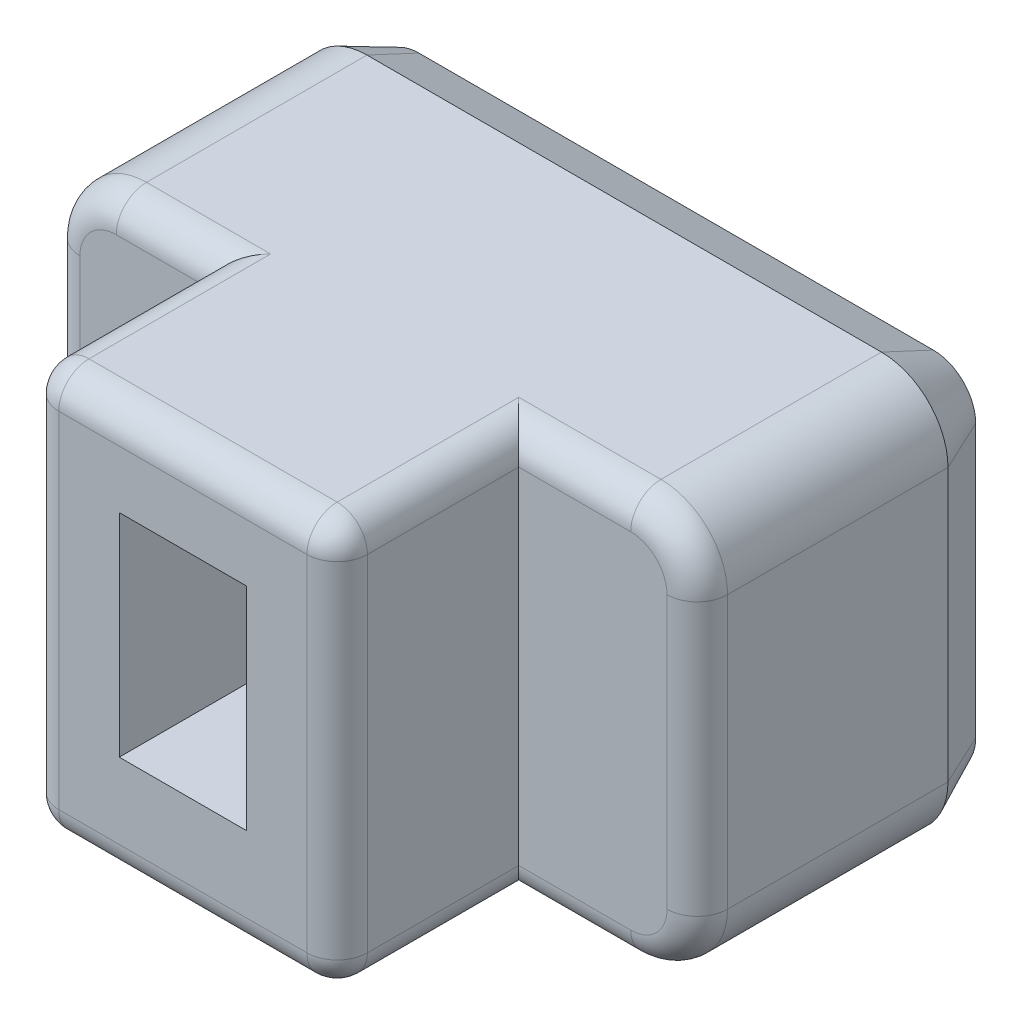
from build123d import *

# Parameters (mm, degrees)
BOSS_EXTRU_1_DEPTH      = 8
ESQUISSE3_W             = 2.1
ESQUISSE3_H             = 3.5
ENL_V_MAT_EXTRU_1_DEPTH = 3
ESQUISSE4_OUTSIDE_W     = 15.69
ESQUISSE4_OUTSIDE_H     = 11.69
ESQUISSE4_OUTSIDE_W_2   = 5.1
ESQUISSE4_OUTSIDE_H_2   = 6.7
ENL_V_MAT_EXTRU_2_DEPTH = 3
CONG_1_R                = 0.5
CHANFREIN1_SIZE         = 0.4
CHANFREIN1_SIZE2        = 0.857802768
ENL_V_MAT_EXTRU_3_DEPTH = 0.3
BOSS_EXTRU_2_START      = -0.2
BOSS_EXTRU_2_DEPTH      = 0.2
BOSS_EXTRU_2_2_DEPTH    = 0.2
BOSS_EXTRU_2_3_DEPTH    = 0.2
BOSS_EXTRU_2_4_DEPTH    = 0.2


with BuildPart() as part:
    # Esquisse2 → Boss.-Extru.1 (new body)
    with BuildSketch(Plane.XY):
        with BuildLine():
            Line((1.1, 0), (9.6, 0))
            ThreePointArc((9.6, 0), (10.377817459, 0.322182541), (10.7, 1.1))
            Line((10.7, 1.1), (10.7, 5.6))
            ThreePointArc((10.7, 5.6), (10.377817459, 6.377817459), (9.6, 6.7))
            Line((9.6, 6.7), (1.1, 6.7))
            ThreePointArc((1.1, 6.7), (0.322182541, 6.377817459), (0, 5.6))
            Line((0, 5.6), (0, 1.1))
            ThreePointArc((0, 1.1), (0.322182541, 0.322182541), (1.1, 0))
        make_face()
    extrude(amount=BOSS_EXTRU_1_DEPTH)

    # Esquisse3 → Enlèv. mat.-Extru.1 (cut)
    with BuildSketch(Plane.XY.offset(8)):
        with Locations((5.2, 3.5)):
            Rectangle(ESQUISSE3_W, ESQUISSE3_H)
    extrude(amount=-ENL_V_MAT_EXTRU_1_DEPTH, mode=Mode.SUBTRACT)

    # Esquisse4 outside → Enlèv. mat.-Extru.2 (cut)
    with BuildSketch(Plane.XY.offset(8)):
        with Locations((5.35, 3.35)):
            Rectangle(ESQUISSE4_OUTSIDE_W, ESQUISSE4_OUTSIDE_H)
        with Locations((5.2, 3.35)):
            Rectangle(ESQUISSE4_OUTSIDE_W_2, ESQUISSE4_OUTSIDE_H_2, mode=Mode.SUBTRACT)
    extrude(amount=-ENL_V_MAT_EXTRU_2_DEPTH, mode=Mode.SUBTRACT)

    # Congé1
    cong_1_edges = [part.edges().sort_by_distance(p)[0] for p in [
        (8.675, 0, 5),
        (10.377817459, 0.322182541, 5),
        (10.7, 3.35, 5),
        (10.377817459, 6.377817459, 5),
        (1.875, 6.7, 5),
        (0.322182541, 6.377817459, 5),
        (1.875, 0, 5),
        (0.322182541, 0.322182541, 5),
        (7.75, 6.7, 6.5),
        (2.65, 6.7, 6.5),
        (7.75, 0, 6.5),
        (2.65, 0, 6.5),
        (2.65, 3.35, 8),
        (5.2, 6.7, 8),
        (7.75, 3.35, 8),
        (5.2, 0, 8),
        (8.675, 6.7, 5),
        (0, 3.35, 5),
    ]]
    fillet(cong_1_edges, radius=CONG_1_R)

    # Chanfrein1
    chanfrein1_edges = [part.edges().sort_by_distance(p)[0] for p in [
        (5.35, 0, 0),
        (10.377817459, 0.322182541, 0),
        (0.322182541, 0.322182541, 0),
        (10.7, 3.35, 0),
        (0, 3.35, 0),
        (10.377817459, 6.377817459, 0),
        (0.322182541, 6.377817459, 0),
        (5.35, 6.7, 0),
    ]]
    chanfrein1_side = [part.faces().sort_by_distance(p)[0] for p in [
        (5.35, 3.35, 0),
    ]]
    chamfer(chanfrein1_edges, length=CHANFREIN1_SIZE, length2=CHANFREIN1_SIZE2, reference=chanfrein1_side[0])

    # Esquisse5 → Enlèv. mat.-Extru.3 (cut)
    # profile 1 of 4: a face of its own
    with BuildSketch(Plane.XY.offset(0.2)):
        with BuildLine():
            Line((1.026823853, 1.568560809), (1.504988917, 1.568560809))
            add(Edge.make_bspline(
                [(1.504988917, 1.568560809), (1.528371843, 1.568737972), (1.573791171, 1.569082096), (1.639742358, 1.574368325), (1.701660368, 1.581533005), (1.759061592, 1.593274377), (1.813075404, 1.605942815), (1.862432078, 1.623594565), (1.907734307, 1.643935254), (1.96262283, 1.675076795), (2.024825483, 1.723696766), (2.090721146, 1.794786229), (2.147567697, 1.87955967), (2.196135604, 1.975912141), (2.234931561, 2.081846849), (2.262975431, 2.194892992), (2.280123943, 2.313560969), (2.282186514, 2.394658433), (2.28323411, 2.43584847)],
                knots=[0, 0, 0, 0, 0.842819012, 1.637103715, 2.384406922, 3.08841103, 3.748535063, 4.382822, 4.974900166, 5.537207606, 6.654665112, 7.805399938, 9.018406966, 10.322311616, 11.68730139, 13.077036195, 14.51540382, 16, 16, 16, 16], degree=3))
            add(Edge.make_bspline(
                [(2.28323411, 2.43584847), (2.282193179, 2.474442117), (2.280155458, 2.549992895), (2.267086011, 2.660666673), (2.243442129, 2.765609887), (2.212514271, 2.865249978), (2.171970391, 2.957751767), (2.12300298, 3.04203836), (2.064299985, 3.116552922), (2.018992008, 3.159230389), (1.996475296, 3.180439816)],
                knots=[0, 0, 0, 0, 1.126158788, 2.204564197, 3.24522682, 4.260993767, 5.244170441, 6.18562216, 7.098308387, 8, 8, 8, 8], degree=3))
            add(Edge.make_bspline(
                [(1.996475296, 3.180439816), (2.024188074, 3.19573908), (2.077707144, 3.225285102), (2.14971342, 3.278030757), (2.212499474, 3.333687309), (2.265616711, 3.394594825), (2.309939208, 3.461112639), (2.349514613, 3.533062439), (2.383553785, 3.611508308), (2.412462035, 3.695834512), (2.434514084, 3.78528162), (2.450578194, 3.878766345), (2.460632936, 3.975761407), (2.462017997, 4.041626774), (2.462721289, 4.075071226)],
                knots=[0, 0, 0, 0, 1.068238828, 2.062988629, 3.007648102, 3.897274313, 4.783988941, 5.702528668, 6.667549239, 7.668574733, 8.710083789, 9.775548232, 10.870490309, 12, 12, 12, 12], degree=3))
            add(Edge.make_bspline(
                [(2.462721289, 4.075071226), (2.462027316, 4.109217601), (2.460664962, 4.176251103), (2.450568908, 4.274636088), (2.434772444, 4.368946942), (2.411560754, 4.459268709), (2.381135043, 4.545298672), (2.345659478, 4.627988931), (2.302459892, 4.706259252), (2.253008767, 4.779739824), (2.199305822, 4.847993928), (2.138845376, 4.906649371), (2.074306301, 4.956769773), (2.005065591, 4.997765953), (1.931575893, 5.029659183), (1.853531864, 5.051869225), (1.771043067, 5.066690144), (1.714224065, 5.067927998), (1.685177219, 5.068560809)],
                knots=[0, 0, 0, 0, 1.162187583, 2.281516105, 3.363145735, 4.414750599, 5.451352767, 6.466734603, 7.474357677, 8.489334277, 9.479565483, 10.42470061, 11.349220251, 12.255172587, 13.156677859, 14.068063032, 15.012360734, 16, 16, 16, 16], degree=3))
            Line((1.685177219, 5.068560809), (1.026823853, 5.068560809))
            Line((1.026823853, 5.068560809), (1.026823853, 1.568560809))
        make_face()
        with BuildLine():
            Line((1.251182828, 1.927535168), (1.251182828, 3.04933004))
            Line((1.251182828, 3.04933004), (1.397016161, 3.04933004))
            add(Edge.make_bspline(
                [(1.397016161, 3.04933004), (1.438412129, 3.048617815), (1.515585022, 3.047290043), (1.622881139, 3.035393479), (1.712741507, 3.014174794), (1.787369187, 2.984681375), (1.848838087, 2.944029726), (1.90155063, 2.894261214), (1.948550417, 2.835153527), (1.987789737, 2.766952898), (2.019007319, 2.691884325), (2.042497219, 2.612533975), (2.055849417, 2.528610242), (2.057851087, 2.471417967), (2.058875135, 2.442158566)],
                knots=[0, 0, 0, 0, 1.443642421, 2.691326396, 3.756960278, 4.656140177, 5.474583852, 6.310856787, 7.17526069, 8.099403828, 9.045608876, 10.00520231, 10.979467334, 12, 12, 12, 12], degree=3))
            add(Edge.make_bspline(
                [(2.058875135, 2.442158566), (2.057575551, 2.404158825), (2.055093558, 2.331585542), (2.031455454, 2.229126814), (1.993897311, 2.138840762), (1.948449461, 2.074453895), (1.904696232, 2.031076558), (1.866581781, 2.003587702), (1.824564806, 1.979319355), (1.777016971, 1.961040965), (1.725872029, 1.945137024), (1.669842749, 1.935050235), (1.609608819, 1.928631751), (1.567874451, 1.927908233), (1.546355103, 1.927535168)],
                knots=[0, 0, 0, 0, 1.642379725, 3.136676343, 4.523260359, 5.850774948, 6.515975718, 7.181560886, 7.879119346, 8.609773276, 9.380960541, 10.194310665, 11.068938667, 12, 12, 12, 12], degree=3))
            Line((1.546355103, 1.927535168), (1.251182828, 1.927535168))
        make_face(mode=Mode.SUBTRACT)
        with BuildLine():
            Line((1.251182828, 3.408304399), (1.251182828, 4.70958645))
            Line((1.251182828, 4.70958645), (1.558975296, 4.70958645))
            add(Edge.make_bspline(
                [(1.558975296, 4.70958645), (1.580941016, 4.709169721), (1.623253584, 4.708366975), (1.684650814, 4.706384891), (1.741123436, 4.699338118), (1.793517508, 4.692398226), (1.8410261, 4.681236116), (1.884912512, 4.670321367), (1.923252585, 4.654406628), (1.968862855, 4.632036867), (2.019713585, 4.596420131), (2.074700893, 4.544350096), (2.122989063, 4.481580211), (2.163584377, 4.40949892), (2.197307547, 4.331601417), (2.22115126, 4.248918562), (2.235424533, 4.162974041), (2.237376372, 4.104572105), (2.238362315, 4.075071226)],
                knots=[0, 0, 0, 0, 0.99003773, 1.907109671, 2.76528307, 3.553060015, 4.286309396, 4.963262082, 5.587021761, 6.152117271, 7.25031408, 8.367579186, 9.553401143, 10.803317956, 12.08641526, 13.369382935, 14.671182516, 16, 16, 16, 16], degree=3))
            add(Edge.make_bspline(
                [(2.238362315, 4.075071226), (2.237282379, 4.038515816), (2.235175023, 3.967182644), (2.214922404, 3.864112086), (2.182606238, 3.767864804), (2.13712823, 3.680037298), (2.080985932, 3.601287437), (2.012232997, 3.537354168), (1.935634971, 3.48383751), (1.877859898, 3.461173001), (1.848538597, 3.449670585)],
                knots=[0, 0, 0, 0, 1.112466578, 2.170835206, 3.186211385, 4.195579665, 5.173863365, 6.115585149, 7.043644711, 8, 8, 8, 8], degree=3))
            add(Edge.make_bspline(
                [(1.848538597, 3.449670585), (1.836661523, 3.44623022), (1.811263186, 3.438873229), (1.769503167, 3.430760766), (1.721775614, 3.423758624), (1.667925084, 3.418604251), (1.608376282, 3.413196523), (1.542855896, 3.411063775), (1.471353423, 3.40857673), (1.421558511, 3.408397686), (1.395613917, 3.408304399)],
                knots=[0, 0, 0, 0, 0.650249806, 1.390516148, 2.235578867, 3.187401739, 4.236027799, 5.380534347, 6.635182444, 8, 8, 8, 8], degree=3))
            Line((1.395613917, 3.408304399), (1.251182828, 3.408304399))
        make_face(mode=Mode.SUBTRACT)
    # profile 2 of 4: a face of its own
    with BuildSketch(Plane.XY.offset(0.2)):
        Polygon((3.808875135, 1.568560809), (4.840926417, 5.068560809), (4.596234911, 5.068560809), (4.265305424, 3.946765938), (3.307573052, 3.946765938), (2.976643565, 5.068560809), (2.731952058, 5.068560809), (3.76400334, 1.568560809), align=None)
        Polygon((3.786439238, 2.322266739), (3.413442443, 3.587791579), (4.160137155, 3.587791579), align=None, mode=Mode.SUBTRACT)
    # profile 3 of 4: a face of its own
    with BuildSketch(Plane.XY.offset(0.2)):
        with BuildLine():
            Line((5.424259751, 1.568560809), (5.896114719, 1.568560809))
            add(Edge.make_bspline(
                [(5.896114719, 1.568560809), (5.927664944, 1.568710504), (5.987968691, 1.568996623), (6.074721645, 1.570732774), (6.153214864, 1.575384221), (6.224145044, 1.579633475), (6.286726392, 1.587040741), (6.341839583, 1.594195908), (6.388969613, 1.603775549), (6.417331173, 1.612312494), (6.430369526, 1.616237091)],
                knots=[0, 0, 0, 0, 1.407282149, 2.689818686, 3.869392946, 4.914346335, 5.858282058, 6.679401601, 7.392895548, 8, 8, 8, 8], degree=3))
            add(Edge.make_bspline(
                [(6.430369526, 1.616237091), (6.447603971, 1.622618673), (6.482210576, 1.635432831), (6.531233225, 1.661982143), (6.578319208, 1.692710749), (6.622937805, 1.728678378), (6.664151442, 1.770550506), (6.7036174, 1.816726381), (6.739924964, 1.868415449), (6.774502964, 1.92428896), (6.804944325, 1.984927743), (6.831532873, 2.049228254), (6.855271559, 2.116634357), (6.872532138, 2.187985883), (6.888151364, 2.262183199), (6.897131184, 2.340098595), (6.903943562, 2.42123829), (6.904663431, 2.476497587), (6.905028981, 2.504558406)],
                knots=[0, 0, 0, 0, 0.821107668, 1.648776614, 2.486680283, 3.333986144, 4.206203121, 5.111011076, 6.047917916, 7.028589376, 8.047728764, 9.078595037, 10.139756632, 11.240097913, 12.359441704, 13.528961701, 14.745200183, 16, 16, 16, 16], degree=3))
            add(Edge.make_bspline(
                [(6.905028981, 2.504558406), (6.904115372, 2.551133706), (6.902340852, 2.641597712), (6.883932957, 2.772696903), (6.856665517, 2.895620891), (6.816713721, 3.008968609), (6.766854772, 3.112017745), (6.705365767, 3.201831055), (6.634583345, 3.278696083), (6.567223984, 3.332191765), (6.507220008, 3.366287223), (6.458849711, 3.389996258), (6.40567214, 3.408404155), (6.34888735, 3.424778097), (6.287907436, 3.437149218), (6.223057013, 3.446239396), (6.154226494, 3.451898922), (6.106929647, 3.452742492), (6.082613116, 3.453176194)],
                knots=[0, 0, 0, 0, 1.558910601, 3.027898852, 4.425391045, 5.769631485, 7.043839751, 8.248801688, 9.400892743, 10.532946836, 11.111592315, 11.710273231, 12.334210728, 12.99329447, 13.688700629, 14.415975114, 15.185611873, 16, 16, 16, 16], degree=3))
            Line((6.082613116, 3.453176194), (6.949900776, 5.068560809))
            Line((6.949900776, 5.068560809), (6.665245328, 5.068560809))
            Line((6.665245328, 5.068560809), (5.797957667, 3.453176194))
            Line((5.797957667, 3.453176194), (5.648618725, 3.453176194))
            Line((5.648618725, 3.453176194), (5.648618725, 5.068560809))
            Line((5.648618725, 5.068560809), (5.424259751, 5.068560809))
            Line((5.424259751, 5.068560809), (5.424259751, 1.568560809))
        make_face()
        with BuildLine():
            Line((5.648618725, 1.927535168), (5.648618725, 3.094201835))
            Line((5.648618725, 3.094201835), (6.069992924, 3.099109688))
            add(Edge.make_bspline(
                [(6.069992924, 3.099109688), (6.108123391, 3.098362877), (6.179222189, 3.096970359), (6.278198619, 3.085453727), (6.361837628, 3.066169237), (6.431109705, 3.036780445), (6.488928859, 2.997996719), (6.538174101, 2.949730875), (6.580828757, 2.891535854), (6.616506866, 2.824862482), (6.64534297, 2.751195421), (6.665123976, 2.67246143), (6.678491409, 2.589612011), (6.679932383, 2.532891903), (6.680670007, 2.503857284)],
                knots=[0, 0, 0, 0, 1.395339324, 2.601776402, 3.641253506, 4.52639321, 5.340202216, 6.175051148, 7.037367115, 7.971344434, 8.935623254, 9.925331959, 10.93799221, 12, 12, 12, 12], degree=3))
            add(Edge.make_bspline(
                [(6.680670007, 2.503857284), (6.67990819, 2.475758408), (6.678408332, 2.42043759), (6.665195213, 2.339666097), (6.6452648, 2.26225379), (6.61588566, 2.190467215), (6.580723986, 2.125106562), (6.539134009, 2.069096432), (6.492430195, 2.022849454), (6.438973616, 1.984623005), (6.372267342, 1.957387389), (6.289865436, 1.941003702), (6.190721095, 1.928580374), (6.118654936, 1.927901244), (6.079808629, 1.927535168)],
                knots=[0, 0, 0, 0, 1.05047501, 2.068165954, 3.054309154, 4.03493336, 4.962272413, 5.82433758, 6.634237283, 7.412809464, 8.266946403, 9.306301865, 10.547997739, 12, 12, 12, 12], degree=3))
            Line((6.079808629, 1.927535168), (5.648618725, 1.927535168))
        make_face(mode=Mode.SUBTRACT)
    # profile 4 of 4: a face of its own
    with BuildSketch(Plane.XY.offset(0.2)):
        with BuildLine():
            add(Edge.make_bspline(
                [(8.549860712, 1.47881722), (8.59414111, 1.480464969), (8.681755943, 1.483725266), (8.810191444, 1.508788948), (8.932994177, 1.550691536), (9.050230994, 1.609392991), (9.161477685, 1.685356446), (9.267367173, 1.777321817), (9.366881747, 1.88620788), (9.460052092, 2.009812749), (9.544938935, 2.14532399), (9.618437417, 2.290671687), (9.681896144, 2.442808086), (9.73302479, 2.60308619), (9.773097035, 2.770630668), (9.80048138, 2.946263138), (9.818855566, 3.129101174), (9.820738453, 3.253777401), (9.821695648, 3.317158566)],
                knots=[0, 0, 0, 0, 0.858454251, 1.698569343, 2.527121736, 3.368410003, 4.233397776, 5.133164337, 6.082708235, 7.089035219, 8.131704346, 9.179798448, 10.244696421, 11.325576536, 12.439338355, 13.582515966, 14.771033121, 16, 16, 16, 16], degree=3))
            add(Edge.make_bspline(
                [(9.821695648, 3.317158566), (9.820635807, 3.380061448), (9.818551605, 3.503761403), (9.80161986, 3.685605125), (9.772809048, 3.860103515), (9.733043964, 4.027263972), (9.681717099, 4.187137068), (9.61915252, 4.339760226), (9.545613348, 4.485458347), (9.460646541, 4.62184395), (9.367514929, 4.746164564), (9.26980585, 4.856959315), (9.165049905, 4.949295858), (9.056277675, 5.026222489), (8.941324129, 5.084859517), (8.821948031, 5.127386554), (8.697297237, 5.153604764), (8.612386108, 5.156727107), (8.569492123, 5.158304399)],
                knots=[0, 0, 0, 0, 1.228341011, 2.415560641, 3.562873061, 4.679897651, 5.768252433, 6.838774251, 7.898184844, 8.951936584, 9.972515691, 10.929235922, 11.831364861, 12.693632108, 13.524448546, 14.342987726, 15.162938237, 16, 16, 16, 16], degree=3))
            add(Edge.make_bspline(
                [(8.569492123, 5.158304399), (8.525892517, 5.156753036), (8.439812083, 5.153690117), (8.313902928, 5.127309494), (8.193139649, 5.085633156), (8.077525723, 5.026957535), (7.967421403, 4.95106212), (7.863159907, 4.858086681), (7.764376306, 4.748600007), (7.671304309, 4.624652739), (7.586726345, 4.488916419), (7.511707733, 4.344765829), (7.449952451, 4.192763075), (7.397456958, 4.034651322), (7.357520031, 3.869295521), (7.330177117, 3.696941954), (7.311699147, 3.517846044), (7.309827123, 3.395965749), (7.308875135, 3.333985489)],
                knots=[0, 0, 0, 0, 0.853619607, 1.685335118, 2.509462992, 3.351267867, 4.217631045, 5.122828636, 6.082475418, 7.102863462, 8.156314248, 9.213263494, 10.283190882, 11.367953664, 12.475420875, 13.61233573, 14.785791812, 16, 16, 16, 16], degree=3))
            add(Edge.make_bspline(
                [(7.308875135, 3.333985489), (7.309453065, 3.292373355), (7.310600162, 3.20978002), (7.318590938, 3.086983301), (7.330971512, 2.966230296), (7.349045764, 2.84778361), (7.373411068, 2.731953638), (7.40104384, 2.618042156), (7.434650915, 2.506597333), (7.474107565, 2.398251286), (7.517035422, 2.29375751), (7.564053336, 2.194382462), (7.615188689, 2.101262167), (7.669968192, 2.013762876), (7.728976365, 1.932418518), (7.791493062, 1.856564306), (7.85722087, 1.785921135), (7.927525446, 1.722762636), (7.999061643, 1.664651907), (8.07390114, 1.616053029), (8.149089361, 1.573117513), (8.226432991, 1.53886673), (8.305240748, 1.511885611), (8.385612397, 1.493284917), (8.467182096, 1.480426772), (8.522233586, 1.479355053), (8.549860712, 1.47881722)],
                knots=[0, 0, 0, 0, 1.217979395, 2.417491463, 3.600543905, 4.770249895, 5.922705374, 7.064205918, 8.20038504, 9.327798428, 10.438126114, 11.506044528, 12.543917262, 13.546049813, 14.525797652, 15.483150642, 16.422018889, 17.34695191, 18.247583506, 19.116560448, 19.955757851, 20.779534139, 21.588607909, 22.390039554, 23.192054908, 24, 24, 24, 24], degree=3))
        make_face()
        with BuildLine():
            add(Edge.make_bspline(
                [(8.560377539, 1.837791579), (8.537897589, 1.838186128), (8.493182522, 1.838970929), (8.42666764, 1.84980445), (8.360834944, 1.864740706), (8.296037605, 1.886675485), (8.232436206, 1.915248601), (8.169396936, 1.949376401), (8.107524755, 1.990550431), (8.04666715, 2.037216112), (7.988521376, 2.089897992), (7.931733728, 2.145572499), (7.880173164, 2.20729657), (7.830839301, 2.272307571), (7.785225536, 2.342277212), (7.742533824, 2.416081612), (7.703911022, 2.494742295), (7.656003377, 2.605332955), (7.606187828, 2.752062314), (7.563534545, 2.937103483), (7.537837595, 3.131806137), (7.534789885, 3.264729422), (7.53323411, 3.332583245)],
                knots=[0, 0, 0, 0, 0.673770933, 1.340203692, 2.017178222, 2.697955501, 3.388593135, 4.107180708, 4.846245151, 5.616265164, 6.405926955, 7.199285233, 8.00020021, 8.816440437, 9.646924476, 10.504528124, 11.373212419, 12.274648853, 14.11965999, 16.012868065, 17.964674552, 20, 20, 20, 20], degree=3))
            add(Edge.make_bspline(
                [(7.53323411, 3.332583245), (7.534188965, 3.383097708), (7.53606267, 3.482221776), (7.550415249, 3.6276914), (7.573377959, 3.767395816), (7.605973089, 3.901173794), (7.649214443, 4.028779549), (7.700988076, 4.150345406), (7.762256846, 4.266100593), (7.832496362, 4.374236554), (7.908697244, 4.473425854), (7.990150842, 4.560188868), (8.075528795, 4.633666469), (8.164052249, 4.695006581), (8.257616174, 4.741804209), (8.355124061, 4.774544496), (8.456360679, 4.796228565), (8.525443086, 4.798288398), (8.560377539, 4.79933004)],
                knots=[0, 0, 0, 0, 1.225521738, 2.404830068, 3.543123245, 4.658543934, 5.74166911, 6.808686826, 7.861444637, 8.915301519, 9.933889238, 10.892645976, 11.797425872, 12.6625057, 13.499395488, 14.326098371, 15.153520557, 16, 16, 16, 16], degree=3))
            add(Edge.make_bspline(
                [(8.560377539, 4.79933004), (8.583776416, 4.798835257), (8.630520375, 4.79784683), (8.699788096, 4.788507754), (8.76781469, 4.772918265), (8.834165015, 4.751177456), (8.899365541, 4.723508447), (8.963236317, 4.689855041), (9.025557807, 4.649586214), (9.086623441, 4.604090865), (9.145101742, 4.553119127), (9.200596972, 4.49758325), (9.252830383, 4.437783064), (9.301177792, 4.372846213), (9.346688291, 4.30359984), (9.388795459, 4.229817003), (9.427370607, 4.151503533), (9.475216086, 4.041193614), (9.524177288, 3.894739082), (9.567099187, 3.710561548), (9.592717651, 3.516530698), (9.595775587, 3.384076036), (9.597336674, 3.316457444)],
                knots=[0, 0, 0, 0, 0.70098958, 1.400367607, 2.090210623, 2.790149611, 3.490053552, 4.2106794, 4.950950835, 5.711618519, 6.49111186, 7.273651766, 8.063026756, 8.868520636, 9.698049155, 10.545105582, 11.412790406, 12.313189685, 14.147191701, 16.031399026, 17.974014596, 20, 20, 20, 20], degree=3))
            add(Edge.make_bspline(
                [(9.597336674, 3.316457444), (9.595764328, 3.249308676), (9.592684705, 3.117789973), (9.567291844, 2.925563655), (9.523991172, 2.743579608), (9.475416061, 2.599080351), (9.42714459, 2.490392173), (9.38897197, 2.412663674), (9.345797147, 2.340074763), (9.300477143, 2.270690611), (9.250453867, 2.206486227), (9.197615566, 2.145810177), (9.141863302, 2.088862818), (9.082152728, 2.037353634), (9.020909332, 1.990236138), (8.957730326, 1.949614452), (8.893794019, 1.91501022), (8.829068895, 1.886841744), (8.76342859, 1.864718325), (8.696662422, 1.849728117), (8.628966004, 1.838980635), (8.583323501, 1.838189372), (8.560377539, 1.837791579)],
                knots=[0, 0, 0, 0, 2.020440238, 3.957268125, 5.821998928, 7.643731336, 8.535017211, 9.400049885, 10.248101364, 11.075243621, 11.89263888, 12.695253358, 13.496016501, 14.288707229, 15.066656554, 15.819757007, 16.546717998, 17.252336784, 17.941856222, 18.627742705, 19.310121904, 20, 20, 20, 20], degree=3))
        make_face(mode=Mode.SUBTRACT)
    extrude(amount=-ENL_V_MAT_EXTRU_3_DEPTH, mode=Mode.SUBTRACT)


with BuildPart() as body_2:
    # Esquisse5<3> → Boss.-Extru.2 (new body)
    with BuildSketch(Plane.XY.offset(0.2).offset(BOSS_EXTRU_2_START)):
        with BuildLine():
            Line((1.026823853, 1.568560809), (1.504988917, 1.568560809))
            add(Edge.make_bspline(
                [(1.504988917, 1.568560809), (1.528371843, 1.568737972), (1.573791171, 1.569082096), (1.639742358, 1.574368325), (1.701660368, 1.581533005), (1.759061592, 1.593274377), (1.813075404, 1.605942815), (1.862432078, 1.623594565), (1.907734307, 1.643935254), (1.96262283, 1.675076795), (2.024825483, 1.723696766), (2.090721146, 1.794786229), (2.147567697, 1.87955967), (2.196135604, 1.975912141), (2.234931561, 2.081846849), (2.262975431, 2.194892992), (2.280123943, 2.313560969), (2.282186514, 2.394658433), (2.28323411, 2.43584847)],
                knots=[0, 0, 0, 0, 0.842819012, 1.637103715, 2.384406922, 3.08841103, 3.748535063, 4.382822, 4.974900166, 5.537207606, 6.654665112, 7.805399938, 9.018406966, 10.322311616, 11.68730139, 13.077036195, 14.51540382, 16, 16, 16, 16], degree=3))
            add(Edge.make_bspline(
                [(2.28323411, 2.43584847), (2.282193179, 2.474442117), (2.280155458, 2.549992895), (2.267086011, 2.660666673), (2.243442129, 2.765609887), (2.212514271, 2.865249978), (2.171970391, 2.957751767), (2.12300298, 3.04203836), (2.064299985, 3.116552922), (2.018992008, 3.159230389), (1.996475296, 3.180439816)],
                knots=[0, 0, 0, 0, 1.126158788, 2.204564197, 3.24522682, 4.260993767, 5.244170441, 6.18562216, 7.098308387, 8, 8, 8, 8], degree=3))
            add(Edge.make_bspline(
                [(1.996475296, 3.180439816), (2.024188074, 3.19573908), (2.077707144, 3.225285102), (2.14971342, 3.278030757), (2.212499474, 3.333687309), (2.265616711, 3.394594825), (2.309939208, 3.461112639), (2.349514613, 3.533062439), (2.383553785, 3.611508308), (2.412462035, 3.695834512), (2.434514084, 3.78528162), (2.450578194, 3.878766345), (2.460632936, 3.975761407), (2.462017997, 4.041626774), (2.462721289, 4.075071226)],
                knots=[0, 0, 0, 0, 1.068238828, 2.062988629, 3.007648102, 3.897274313, 4.783988941, 5.702528668, 6.667549239, 7.668574733, 8.710083789, 9.775548232, 10.870490309, 12, 12, 12, 12], degree=3))
            add(Edge.make_bspline(
                [(2.462721289, 4.075071226), (2.462027316, 4.109217601), (2.460664962, 4.176251103), (2.450568908, 4.274636088), (2.434772444, 4.368946942), (2.411560754, 4.459268709), (2.381135043, 4.545298672), (2.345659478, 4.627988931), (2.302459892, 4.706259252), (2.253008767, 4.779739824), (2.199305822, 4.847993928), (2.138845376, 4.906649371), (2.074306301, 4.956769773), (2.005065591, 4.997765953), (1.931575893, 5.029659183), (1.853531864, 5.051869225), (1.771043067, 5.066690144), (1.714224065, 5.067927998), (1.685177219, 5.068560809)],
                knots=[0, 0, 0, 0, 1.162187583, 2.281516105, 3.363145735, 4.414750599, 5.451352767, 6.466734603, 7.474357677, 8.489334277, 9.479565483, 10.42470061, 11.349220251, 12.255172587, 13.156677859, 14.068063032, 15.012360734, 16, 16, 16, 16], degree=3))
            Line((1.685177219, 5.068560809), (1.026823853, 5.068560809))
            Line((1.026823853, 5.068560809), (1.026823853, 1.568560809))
        make_face()
        with BuildLine():
            Line((1.251182828, 1.927535168), (1.251182828, 3.04933004))
            Line((1.251182828, 3.04933004), (1.397016161, 3.04933004))
            add(Edge.make_bspline(
                [(1.397016161, 3.04933004), (1.438412129, 3.048617815), (1.515585022, 3.047290043), (1.622881139, 3.035393479), (1.712741507, 3.014174794), (1.787369187, 2.984681375), (1.848838087, 2.944029726), (1.90155063, 2.894261214), (1.948550417, 2.835153527), (1.987789737, 2.766952898), (2.019007319, 2.691884325), (2.042497219, 2.612533975), (2.055849417, 2.528610242), (2.057851087, 2.471417967), (2.058875135, 2.442158566)],
                knots=[0, 0, 0, 0, 1.443642421, 2.691326396, 3.756960278, 4.656140177, 5.474583852, 6.310856787, 7.17526069, 8.099403828, 9.045608876, 10.00520231, 10.979467334, 12, 12, 12, 12], degree=3))
            add(Edge.make_bspline(
                [(2.058875135, 2.442158566), (2.057575551, 2.404158825), (2.055093558, 2.331585542), (2.031455454, 2.229126814), (1.993897311, 2.138840762), (1.948449461, 2.074453895), (1.904696232, 2.031076558), (1.866581781, 2.003587702), (1.824564806, 1.979319355), (1.777016971, 1.961040965), (1.725872029, 1.945137024), (1.669842749, 1.935050235), (1.609608819, 1.928631751), (1.567874451, 1.927908233), (1.546355103, 1.927535168)],
                knots=[0, 0, 0, 0, 1.642379725, 3.136676343, 4.523260359, 5.850774948, 6.515975718, 7.181560886, 7.879119346, 8.609773276, 9.380960541, 10.194310665, 11.068938667, 12, 12, 12, 12], degree=3))
            Line((1.546355103, 1.927535168), (1.251182828, 1.927535168))
        make_face(mode=Mode.SUBTRACT)
        with BuildLine():
            Line((1.251182828, 3.408304399), (1.251182828, 4.70958645))
            Line((1.251182828, 4.70958645), (1.558975296, 4.70958645))
            add(Edge.make_bspline(
                [(1.558975296, 4.70958645), (1.580941016, 4.709169721), (1.623253584, 4.708366975), (1.684650814, 4.706384891), (1.741123436, 4.699338118), (1.793517508, 4.692398226), (1.8410261, 4.681236116), (1.884912512, 4.670321367), (1.923252585, 4.654406628), (1.968862855, 4.632036867), (2.019713585, 4.596420131), (2.074700893, 4.544350096), (2.122989063, 4.481580211), (2.163584377, 4.40949892), (2.197307547, 4.331601417), (2.22115126, 4.248918562), (2.235424533, 4.162974041), (2.237376372, 4.104572105), (2.238362315, 4.075071226)],
                knots=[0, 0, 0, 0, 0.99003773, 1.907109671, 2.76528307, 3.553060015, 4.286309396, 4.963262082, 5.587021761, 6.152117271, 7.25031408, 8.367579186, 9.553401143, 10.803317956, 12.08641526, 13.369382935, 14.671182516, 16, 16, 16, 16], degree=3))
            add(Edge.make_bspline(
                [(2.238362315, 4.075071226), (2.237282379, 4.038515816), (2.235175023, 3.967182644), (2.214922404, 3.864112086), (2.182606238, 3.767864804), (2.13712823, 3.680037298), (2.080985932, 3.601287437), (2.012232997, 3.537354168), (1.935634971, 3.48383751), (1.877859898, 3.461173001), (1.848538597, 3.449670585)],
                knots=[0, 0, 0, 0, 1.112466578, 2.170835206, 3.186211385, 4.195579665, 5.173863365, 6.115585149, 7.043644711, 8, 8, 8, 8], degree=3))
            add(Edge.make_bspline(
                [(1.848538597, 3.449670585), (1.836661523, 3.44623022), (1.811263186, 3.438873229), (1.769503167, 3.430760766), (1.721775614, 3.423758624), (1.667925084, 3.418604251), (1.608376282, 3.413196523), (1.542855896, 3.411063775), (1.471353423, 3.40857673), (1.421558511, 3.408397686), (1.395613917, 3.408304399)],
                knots=[0, 0, 0, 0, 0.650249806, 1.390516148, 2.235578867, 3.187401739, 4.236027799, 5.380534347, 6.635182444, 8, 8, 8, 8], degree=3))
            Line((1.395613917, 3.408304399), (1.251182828, 3.408304399))
        make_face(mode=Mode.SUBTRACT)
    extrude(amount=-BOSS_EXTRU_2_DEPTH)


with BuildPart() as body_3:
    # Esquisse5<3> → Boss.-Extru.2 2 (new body)
    with BuildSketch(Plane.XY.offset(0.2).offset(BOSS_EXTRU_2_START)):
        Polygon((3.808875135, 1.568560809), (4.840926417, 5.068560809), (4.596234911, 5.068560809), (4.265305424, 3.946765938), (3.307573052, 3.946765938), (2.976643565, 5.068560809), (2.731952058, 5.068560809), (3.76400334, 1.568560809), align=None)
        Polygon((3.786439238, 2.322266739), (3.413442443, 3.587791579), (4.160137155, 3.587791579), align=None, mode=Mode.SUBTRACT)
    extrude(amount=-BOSS_EXTRU_2_2_DEPTH)


with BuildPart() as body_4:
    # Esquisse5<3> → Boss.-Extru.2 3 (new body)
    with BuildSketch(Plane.XY.offset(0.2).offset(BOSS_EXTRU_2_START)):
        with BuildLine():
            Line((5.424259751, 1.568560809), (5.896114719, 1.568560809))
            add(Edge.make_bspline(
                [(5.896114719, 1.568560809), (5.927664944, 1.568710504), (5.987968691, 1.568996623), (6.074721645, 1.570732774), (6.153214864, 1.575384221), (6.224145044, 1.579633475), (6.286726392, 1.587040741), (6.341839583, 1.594195908), (6.388969613, 1.603775549), (6.417331173, 1.612312494), (6.430369526, 1.616237091)],
                knots=[0, 0, 0, 0, 1.407282149, 2.689818686, 3.869392946, 4.914346335, 5.858282058, 6.679401601, 7.392895548, 8, 8, 8, 8], degree=3))
            add(Edge.make_bspline(
                [(6.430369526, 1.616237091), (6.447603971, 1.622618673), (6.482210576, 1.635432831), (6.531233225, 1.661982143), (6.578319208, 1.692710749), (6.622937805, 1.728678378), (6.664151442, 1.770550506), (6.7036174, 1.816726381), (6.739924964, 1.868415449), (6.774502964, 1.92428896), (6.804944325, 1.984927743), (6.831532873, 2.049228254), (6.855271559, 2.116634357), (6.872532138, 2.187985883), (6.888151364, 2.262183199), (6.897131184, 2.340098595), (6.903943562, 2.42123829), (6.904663431, 2.476497587), (6.905028981, 2.504558406)],
                knots=[0, 0, 0, 0, 0.821107668, 1.648776614, 2.486680283, 3.333986144, 4.206203121, 5.111011076, 6.047917916, 7.028589376, 8.047728764, 9.078595037, 10.139756632, 11.240097913, 12.359441704, 13.528961701, 14.745200183, 16, 16, 16, 16], degree=3))
            add(Edge.make_bspline(
                [(6.905028981, 2.504558406), (6.904115372, 2.551133706), (6.902340852, 2.641597712), (6.883932957, 2.772696903), (6.856665517, 2.895620891), (6.816713721, 3.008968609), (6.766854772, 3.112017745), (6.705365767, 3.201831055), (6.634583345, 3.278696083), (6.567223984, 3.332191765), (6.507220008, 3.366287223), (6.458849711, 3.389996258), (6.40567214, 3.408404155), (6.34888735, 3.424778097), (6.287907436, 3.437149218), (6.223057013, 3.446239396), (6.154226494, 3.451898922), (6.106929647, 3.452742492), (6.082613116, 3.453176194)],
                knots=[0, 0, 0, 0, 1.558910601, 3.027898852, 4.425391045, 5.769631485, 7.043839751, 8.248801688, 9.400892743, 10.532946836, 11.111592315, 11.710273231, 12.334210728, 12.99329447, 13.688700629, 14.415975114, 15.185611873, 16, 16, 16, 16], degree=3))
            Line((6.082613116, 3.453176194), (6.949900776, 5.068560809))
            Line((6.949900776, 5.068560809), (6.665245328, 5.068560809))
            Line((6.665245328, 5.068560809), (5.797957667, 3.453176194))
            Line((5.797957667, 3.453176194), (5.648618725, 3.453176194))
            Line((5.648618725, 3.453176194), (5.648618725, 5.068560809))
            Line((5.648618725, 5.068560809), (5.424259751, 5.068560809))
            Line((5.424259751, 5.068560809), (5.424259751, 1.568560809))
        make_face()
        with BuildLine():
            Line((5.648618725, 1.927535168), (5.648618725, 3.094201835))
            Line((5.648618725, 3.094201835), (6.069992924, 3.099109688))
            add(Edge.make_bspline(
                [(6.069992924, 3.099109688), (6.108123391, 3.098362877), (6.179222189, 3.096970359), (6.278198619, 3.085453727), (6.361837628, 3.066169237), (6.431109705, 3.036780445), (6.488928859, 2.997996719), (6.538174101, 2.949730875), (6.580828757, 2.891535854), (6.616506866, 2.824862482), (6.64534297, 2.751195421), (6.665123976, 2.67246143), (6.678491409, 2.589612011), (6.679932383, 2.532891903), (6.680670007, 2.503857284)],
                knots=[0, 0, 0, 0, 1.395339324, 2.601776402, 3.641253506, 4.52639321, 5.340202216, 6.175051148, 7.037367115, 7.971344434, 8.935623254, 9.925331959, 10.93799221, 12, 12, 12, 12], degree=3))
            add(Edge.make_bspline(
                [(6.680670007, 2.503857284), (6.67990819, 2.475758408), (6.678408332, 2.42043759), (6.665195213, 2.339666097), (6.6452648, 2.26225379), (6.61588566, 2.190467215), (6.580723986, 2.125106562), (6.539134009, 2.069096432), (6.492430195, 2.022849454), (6.438973616, 1.984623005), (6.372267342, 1.957387389), (6.289865436, 1.941003702), (6.190721095, 1.928580374), (6.118654936, 1.927901244), (6.079808629, 1.927535168)],
                knots=[0, 0, 0, 0, 1.05047501, 2.068165954, 3.054309154, 4.03493336, 4.962272413, 5.82433758, 6.634237283, 7.412809464, 8.266946403, 9.306301865, 10.547997739, 12, 12, 12, 12], degree=3))
            Line((6.079808629, 1.927535168), (5.648618725, 1.927535168))
        make_face(mode=Mode.SUBTRACT)
    extrude(amount=-BOSS_EXTRU_2_3_DEPTH)


with BuildPart() as body_5:
    # Esquisse5<3> → Boss.-Extru.2 4 (new body)
    with BuildSketch(Plane.XY.offset(0.2).offset(BOSS_EXTRU_2_START)):
        with BuildLine():
            add(Edge.make_bspline(
                [(8.549860712, 1.47881722), (8.59414111, 1.480464969), (8.681755943, 1.483725266), (8.810191444, 1.508788948), (8.932994177, 1.550691536), (9.050230994, 1.609392991), (9.161477685, 1.685356446), (9.267367173, 1.777321817), (9.366881747, 1.88620788), (9.460052092, 2.009812749), (9.544938935, 2.14532399), (9.618437417, 2.290671687), (9.681896144, 2.442808086), (9.73302479, 2.60308619), (9.773097035, 2.770630668), (9.80048138, 2.946263138), (9.818855566, 3.129101174), (9.820738453, 3.253777401), (9.821695648, 3.317158566)],
                knots=[0, 0, 0, 0, 0.858454251, 1.698569343, 2.527121736, 3.368410003, 4.233397776, 5.133164337, 6.082708235, 7.089035219, 8.131704346, 9.179798448, 10.244696421, 11.325576536, 12.439338355, 13.582515966, 14.771033121, 16, 16, 16, 16], degree=3))
            add(Edge.make_bspline(
                [(9.821695648, 3.317158566), (9.820635807, 3.380061448), (9.818551605, 3.503761403), (9.80161986, 3.685605125), (9.772809048, 3.860103515), (9.733043964, 4.027263972), (9.681717099, 4.187137068), (9.61915252, 4.339760226), (9.545613348, 4.485458347), (9.460646541, 4.62184395), (9.367514929, 4.746164564), (9.26980585, 4.856959315), (9.165049905, 4.949295858), (9.056277675, 5.026222489), (8.941324129, 5.084859517), (8.821948031, 5.127386554), (8.697297237, 5.153604764), (8.612386108, 5.156727107), (8.569492123, 5.158304399)],
                knots=[0, 0, 0, 0, 1.228341011, 2.415560641, 3.562873061, 4.679897651, 5.768252433, 6.838774251, 7.898184844, 8.951936584, 9.972515691, 10.929235922, 11.831364861, 12.693632108, 13.524448546, 14.342987726, 15.162938237, 16, 16, 16, 16], degree=3))
            add(Edge.make_bspline(
                [(8.569492123, 5.158304399), (8.525892517, 5.156753036), (8.439812083, 5.153690117), (8.313902928, 5.127309494), (8.193139649, 5.085633156), (8.077525723, 5.026957535), (7.967421403, 4.95106212), (7.863159907, 4.858086681), (7.764376306, 4.748600007), (7.671304309, 4.624652739), (7.586726345, 4.488916419), (7.511707733, 4.344765829), (7.449952451, 4.192763075), (7.397456958, 4.034651322), (7.357520031, 3.869295521), (7.330177117, 3.696941954), (7.311699147, 3.517846044), (7.309827123, 3.395965749), (7.308875135, 3.333985489)],
                knots=[0, 0, 0, 0, 0.853619607, 1.685335118, 2.509462992, 3.351267867, 4.217631045, 5.122828636, 6.082475418, 7.102863462, 8.156314248, 9.213263494, 10.283190882, 11.367953664, 12.475420875, 13.61233573, 14.785791812, 16, 16, 16, 16], degree=3))
            add(Edge.make_bspline(
                [(7.308875135, 3.333985489), (7.309453065, 3.292373355), (7.310600162, 3.20978002), (7.318590938, 3.086983301), (7.330971512, 2.966230296), (7.349045764, 2.84778361), (7.373411068, 2.731953638), (7.40104384, 2.618042156), (7.434650915, 2.506597333), (7.474107565, 2.398251286), (7.517035422, 2.29375751), (7.564053336, 2.194382462), (7.615188689, 2.101262167), (7.669968192, 2.013762876), (7.728976365, 1.932418518), (7.791493062, 1.856564306), (7.85722087, 1.785921135), (7.927525446, 1.722762636), (7.999061643, 1.664651907), (8.07390114, 1.616053029), (8.149089361, 1.573117513), (8.226432991, 1.53886673), (8.305240748, 1.511885611), (8.385612397, 1.493284917), (8.467182096, 1.480426772), (8.522233586, 1.479355053), (8.549860712, 1.47881722)],
                knots=[0, 0, 0, 0, 1.217979395, 2.417491463, 3.600543905, 4.770249895, 5.922705374, 7.064205918, 8.20038504, 9.327798428, 10.438126114, 11.506044528, 12.543917262, 13.546049813, 14.525797652, 15.483150642, 16.422018889, 17.34695191, 18.247583506, 19.116560448, 19.955757851, 20.779534139, 21.588607909, 22.390039554, 23.192054908, 24, 24, 24, 24], degree=3))
        make_face()
        with BuildLine():
            add(Edge.make_bspline(
                [(8.560377539, 1.837791579), (8.537897589, 1.838186128), (8.493182522, 1.838970929), (8.42666764, 1.84980445), (8.360834944, 1.864740706), (8.296037605, 1.886675485), (8.232436206, 1.915248601), (8.169396936, 1.949376401), (8.107524755, 1.990550431), (8.04666715, 2.037216112), (7.988521376, 2.089897992), (7.931733728, 2.145572499), (7.880173164, 2.20729657), (7.830839301, 2.272307571), (7.785225536, 2.342277212), (7.742533824, 2.416081612), (7.703911022, 2.494742295), (7.656003377, 2.605332955), (7.606187828, 2.752062314), (7.563534545, 2.937103483), (7.537837595, 3.131806137), (7.534789885, 3.264729422), (7.53323411, 3.332583245)],
                knots=[0, 0, 0, 0, 0.673770933, 1.340203692, 2.017178222, 2.697955501, 3.388593135, 4.107180708, 4.846245151, 5.616265164, 6.405926955, 7.199285233, 8.00020021, 8.816440437, 9.646924476, 10.504528124, 11.373212419, 12.274648853, 14.11965999, 16.012868065, 17.964674552, 20, 20, 20, 20], degree=3))
            add(Edge.make_bspline(
                [(7.53323411, 3.332583245), (7.534188965, 3.383097708), (7.53606267, 3.482221776), (7.550415249, 3.6276914), (7.573377959, 3.767395816), (7.605973089, 3.901173794), (7.649214443, 4.028779549), (7.700988076, 4.150345406), (7.762256846, 4.266100593), (7.832496362, 4.374236554), (7.908697244, 4.473425854), (7.990150842, 4.560188868), (8.075528795, 4.633666469), (8.164052249, 4.695006581), (8.257616174, 4.741804209), (8.355124061, 4.774544496), (8.456360679, 4.796228565), (8.525443086, 4.798288398), (8.560377539, 4.79933004)],
                knots=[0, 0, 0, 0, 1.225521738, 2.404830068, 3.543123245, 4.658543934, 5.74166911, 6.808686826, 7.861444637, 8.915301519, 9.933889238, 10.892645976, 11.797425872, 12.6625057, 13.499395488, 14.326098371, 15.153520557, 16, 16, 16, 16], degree=3))
            add(Edge.make_bspline(
                [(8.560377539, 4.79933004), (8.583776416, 4.798835257), (8.630520375, 4.79784683), (8.699788096, 4.788507754), (8.76781469, 4.772918265), (8.834165015, 4.751177456), (8.899365541, 4.723508447), (8.963236317, 4.689855041), (9.025557807, 4.649586214), (9.086623441, 4.604090865), (9.145101742, 4.553119127), (9.200596972, 4.49758325), (9.252830383, 4.437783064), (9.301177792, 4.372846213), (9.346688291, 4.30359984), (9.388795459, 4.229817003), (9.427370607, 4.151503533), (9.475216086, 4.041193614), (9.524177288, 3.894739082), (9.567099187, 3.710561548), (9.592717651, 3.516530698), (9.595775587, 3.384076036), (9.597336674, 3.316457444)],
                knots=[0, 0, 0, 0, 0.70098958, 1.400367607, 2.090210623, 2.790149611, 3.490053552, 4.2106794, 4.950950835, 5.711618519, 6.49111186, 7.273651766, 8.063026756, 8.868520636, 9.698049155, 10.545105582, 11.412790406, 12.313189685, 14.147191701, 16.031399026, 17.974014596, 20, 20, 20, 20], degree=3))
            add(Edge.make_bspline(
                [(9.597336674, 3.316457444), (9.595764328, 3.249308676), (9.592684705, 3.117789973), (9.567291844, 2.925563655), (9.523991172, 2.743579608), (9.475416061, 2.599080351), (9.42714459, 2.490392173), (9.38897197, 2.412663674), (9.345797147, 2.340074763), (9.300477143, 2.270690611), (9.250453867, 2.206486227), (9.197615566, 2.145810177), (9.141863302, 2.088862818), (9.082152728, 2.037353634), (9.020909332, 1.990236138), (8.957730326, 1.949614452), (8.893794019, 1.91501022), (8.829068895, 1.886841744), (8.76342859, 1.864718325), (8.696662422, 1.849728117), (8.628966004, 1.838980635), (8.583323501, 1.838189372), (8.560377539, 1.837791579)],
                knots=[0, 0, 0, 0, 2.020440238, 3.957268125, 5.821998928, 7.643731336, 8.535017211, 9.400049885, 10.248101364, 11.075243621, 11.89263888, 12.695253358, 13.496016501, 14.288707229, 15.066656554, 15.819757007, 16.546717998, 17.252336784, 17.941856222, 18.627742705, 19.310121904, 20, 20, 20, 20], degree=3))
        make_face(mode=Mode.SUBTRACT)
    extrude(amount=-BOSS_EXTRU_2_4_DEPTH)


solid = Compound([part.part, body_2.part, body_3.part, body_4.part, body_5.part])
